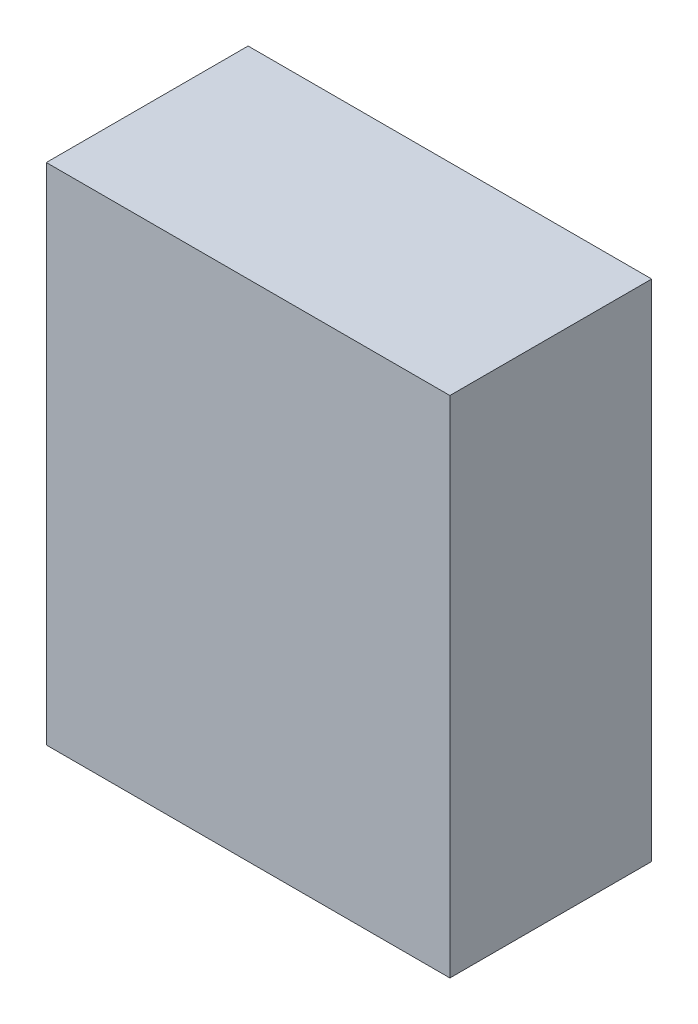
from build123d import *

# Parameters (mm, degrees)
SKETCH1_W           = 800
SKETCH1_H           = 1000
BOSS_EXTRUDE1_DEPTH = 400


with BuildPart() as part:
    # Sketch1 → Boss-Extrude1 (new body)
    with BuildSketch(Plane.XY):
        Rectangle(SKETCH1_W, SKETCH1_H)
    extrude(amount=BOSS_EXTRUDE1_DEPTH)


solid = part.part
